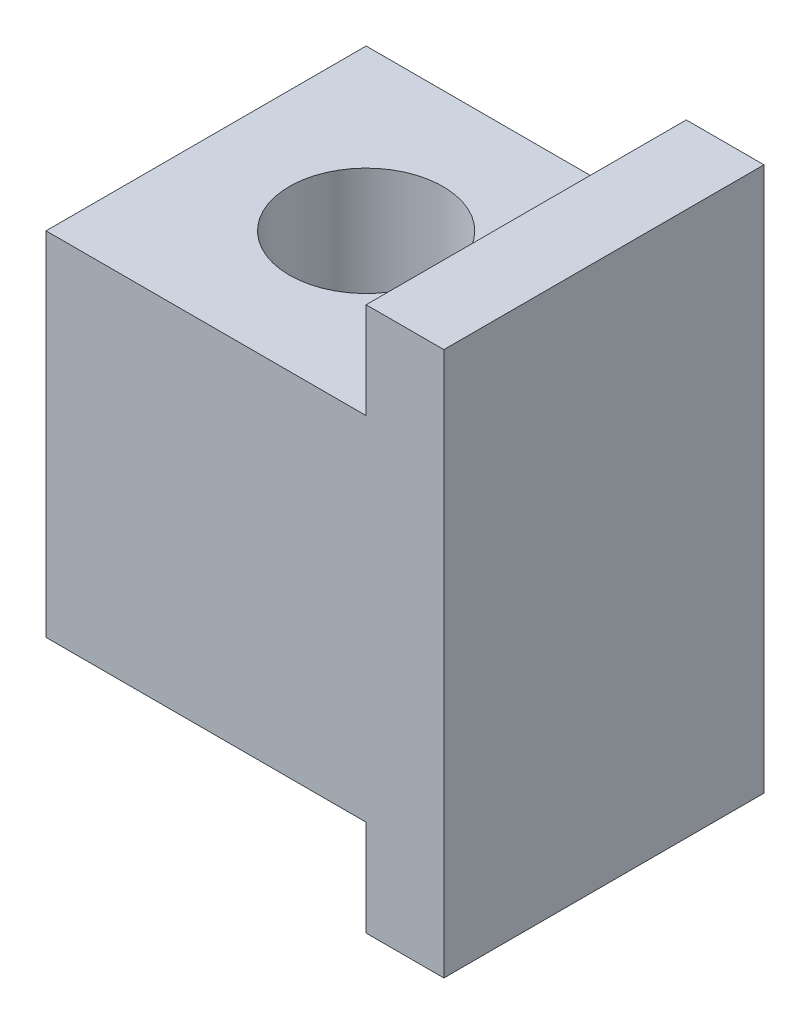
from build123d import *

# Parameters (mm, degrees)
BOSS_EXTRUDE1_DEPTH = 12.7
SKETCH3_R           = 3.048
CUT_EXTRUDE1_DEPTH  = 17.78


with BuildPart() as part:
    # Sketch2 → Boss-Extrude1 (new body)
    with BuildSketch(Plane.XY):
        Polygon((12.7, 0), (12.7, 3.81), (15.782823405, 3.81), (15.782823405, -17.78), (12.7, -17.78), (12.7, -13.97), (0, -13.97), (0, 0), align=None)
    extrude(amount=BOSS_EXTRUDE1_DEPTH)

    # Sketch3 → Cut-Extrude1 (cut)
    with BuildSketch(Plane(origin=(0, 0, 0), x_dir=(1, 0, 0), z_dir=(0, 1, 0))):
        with Locations(Location((6.35, -6.35, 0), (0, 0, 270))):
            Circle(SKETCH3_R)
    extrude(amount=-CUT_EXTRUDE1_DEPTH, mode=Mode.SUBTRACT)


solid = part.part
